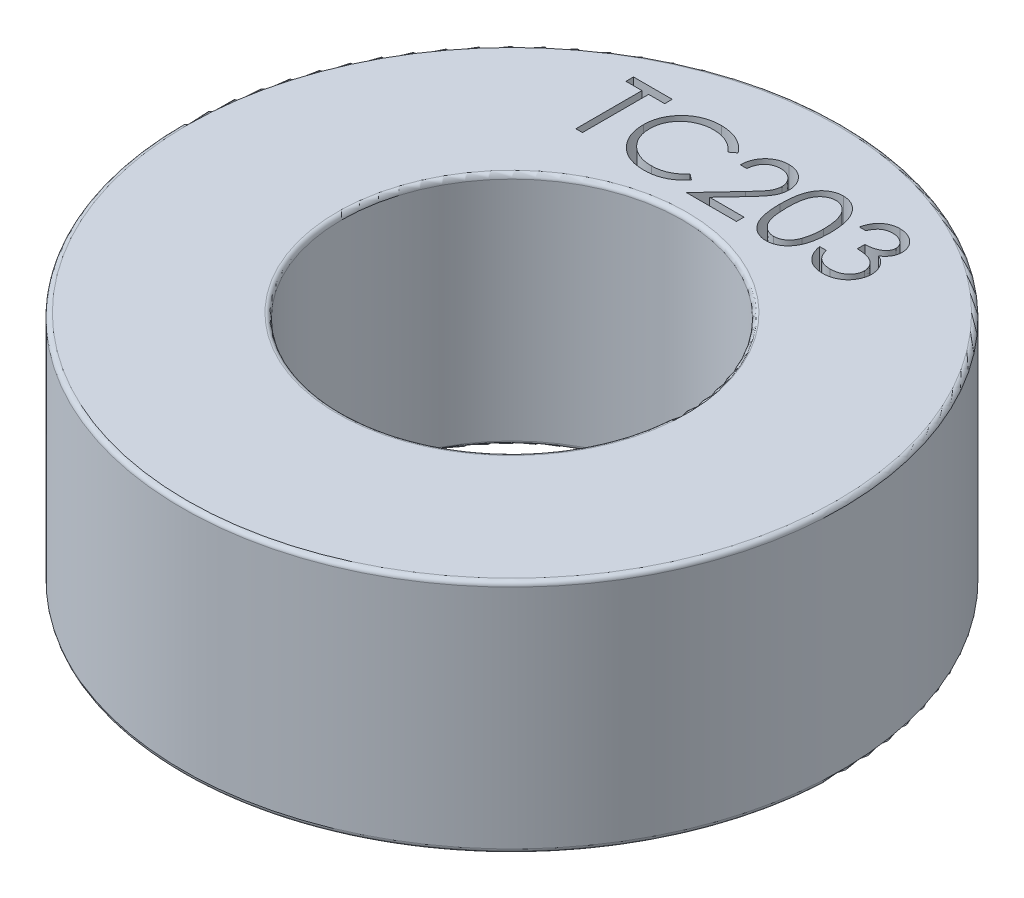
from build123d import *

# Parameters (mm, degrees)
CUT_EXTRUDE1_DEPTH = 1


with BuildPart() as part:
    # Toroidal Core TC229 → Revolve2 (revolve)
    with BuildSketch(Plane.XY, mode=Mode.PRIVATE) as revolve2_sk:
        with BuildLine():
            Line((5.646058459, 0), (10.503941541, 0))
            ThreePointArc((10.503941541, 0), (10.607220468, 0.042779532), (10.65, 0.146058459))
            Line((10.65, 0.146058459), (10.65, 7.473941541))
            ThreePointArc((10.65, 7.473941541), (10.607220468, 7.577220468), (10.503941541, 7.62))
            Line((10.503941541, 7.62), (5.646058459, 7.62))
            ThreePointArc((5.646058459, 7.62), (5.542779532, 7.577220468), (5.5, 7.473941541))
            Line((5.5, 7.473941541), (5.5, 0.146058459))
            ThreePointArc((5.5, 0.146058459), (5.542779532, 0.042779532), (5.646058459, 0))
        make_face()
    revolve(revolve2_sk.sketch.rotate(Axis((0, -8.107972275, 0), (0, 1, 0)), 90), axis=Axis((0, -8.107972275, 0), (0, 1, 0)))

    # Sketch1 → Cut-Extrude1 (cut)
    # profile 1 of 5: a face of its own
    with BuildSketch(Plane(origin=(0, 7.62, 0), x_dir=(1, 0, 0), z_dir=(0, 1, 0))):
        Polygon((-4.639181187, 8.322520552), (-4.639181187, 8.566751321), (-3.387498495, 8.566751321), (-3.387498495, 8.322520552), (-3.90648888, 8.322520552), (-3.90648888, 6.185501321), (-4.120190803, 6.185501321), (-4.120190803, 8.322520552), align=None)
    # profile 2 of 5: a face of its own
    with BuildSketch(Plane(origin=(0, 7.62, 0), x_dir=(1, 0, 0), z_dir=(0, 1, 0))):
        with BuildLine():
            Line((-0.823075418, 8.129807211), (-1.010064601, 7.986703244))
            add(Edge.make_bspline(
                [(-1.010064601, 7.986703244), (-1.023403607, 8.002600449), (-1.049901781, 8.034180529), (-1.092532417, 8.078525898), (-1.136960856, 8.120072085), (-1.183170115, 8.159017006), (-1.231991945, 8.19399877), (-1.282243666, 8.22684036), (-1.334765908, 8.256277874), (-1.407395213, 8.291971442), (-1.502405624, 8.329218379), (-1.622008899, 8.360448971), (-1.746861985, 8.380329806), (-1.832041066, 8.382483029), (-1.875366584, 8.383578244)],
                knots=[0, 0, 0, 0, 0.757959112, 1.505699292, 2.245454638, 2.979532153, 3.711538275, 4.438200793, 5.171680507, 5.909471876, 7.393775596, 8.890124382, 10.418191784, 12, 12, 12, 12], degree=3))
            add(Edge.make_bspline(
                [(-1.875366584, 8.383578244), (-1.899235757, 8.383303406), (-1.946752575, 8.382756279), (-2.017270555, 8.375538285), (-2.086471756, 8.365393337), (-2.154311164, 8.350340215), (-2.220702427, 8.331308844), (-2.286079579, 8.308567625), (-2.349496076, 8.280431564), (-2.411829199, 8.249333623), (-2.471550412, 8.214208522), (-2.528057507, 8.175895331), (-2.581144392, 8.134822785), (-2.630853062, 8.090836943), (-2.677234334, 8.044135895), (-2.71995213, 7.994221941), (-2.758858632, 7.941254658), (-2.794725037, 7.885932501), (-2.826846557, 7.82841661), (-2.853740993, 7.768494107), (-2.877556978, 7.707191137), (-2.896402355, 7.643815079), (-2.911318857, 7.578811876), (-2.921611071, 7.512007072), (-2.928746977, 7.44354023), (-2.929291383, 7.397133536), (-2.929565803, 7.373741255)],
                knots=[0, 0, 0, 0, 1.054917814, 2.100044995, 3.131103042, 4.146048494, 5.169673617, 6.183595914, 7.203665975, 8.234915748, 9.262203917, 10.264457458, 11.251630812, 12.227803204, 13.197192746, 14.159520551, 15.12972552, 16.100847026, 17.073214652, 18.039054194, 19.002613845, 19.979014051, 20.95965708, 21.949030935, 22.966165397, 24, 24, 24, 24], degree=3))
            add(Edge.make_bspline(
                [(-2.929565803, 7.373741255), (-2.928707315, 7.338545482), (-2.927021789, 7.26944325), (-2.912021047, 7.168226103), (-2.889225619, 7.071261144), (-2.855061092, 6.979154502), (-2.812934024, 6.890770422), (-2.759702465, 6.807604345), (-2.698050857, 6.728399504), (-2.627107011, 6.655027784), (-2.549270196, 6.588003268), (-2.465757778, 6.52898189), (-2.376777754, 6.479781943), (-2.283312582, 6.438840808), (-2.18464303, 6.407369713), (-2.08094653, 6.385214479), (-1.972448619, 6.37076221), (-1.898310509, 6.369378576), (-1.860579174, 6.368674398)],
                knots=[0, 0, 0, 0, 1.029171465, 2.020641659, 2.987623507, 3.938342917, 4.889210282, 5.84687017, 6.821220943, 7.821438502, 8.827599549, 9.822697543, 10.807740252, 11.797342354, 12.80366471, 13.83203677, 14.896651826, 16, 16, 16, 16], degree=3))
            add(Edge.make_bspline(
                [(-1.860579174, 6.368674398), (-1.819007523, 6.369823372), (-1.737184569, 6.372084826), (-1.617191323, 6.391243172), (-1.502322704, 6.422306863), (-1.392572533, 6.465780271), (-1.288250212, 6.522294333), (-1.189192484, 6.590804853), (-1.095315737, 6.671963522), (-1.038865632, 6.733932579), (-1.010064601, 6.765549398)],
                knots=[0, 0, 0, 0, 1.028121516, 2.023589091, 2.998037872, 3.967518031, 4.937445131, 5.927275754, 6.942489185, 8, 8, 8, 8], degree=3))
            Line((-1.010064601, 6.765549398), (-0.823075418, 6.623876472))
            add(Edge.make_bspline(
                [(-0.823075418, 6.623876472), (-0.838123632, 6.604460132), (-0.86814798, 6.565720456), (-0.916764952, 6.511107025), (-0.967980399, 6.459737315), (-1.022174731, 6.412025487), (-1.078724514, 6.367016824), (-1.138645141, 6.325990042), (-1.201148893, 6.288372494), (-1.266023994, 6.253928104), (-1.333201514, 6.223368335), (-1.40260096, 6.197206039), (-1.473923191, 6.174669284), (-1.547171467, 6.156128234), (-1.622497723, 6.1416563), (-1.699630135, 6.131981843), (-1.778735175, 6.125353862), (-1.832103356, 6.124749762), (-1.859148134, 6.124443629)],
                knots=[0, 0, 0, 0, 0.986787822, 1.968848986, 2.935600012, 3.899624008, 4.868462664, 5.837806735, 6.815139263, 7.798259679, 8.787526145, 9.778297419, 10.776456485, 11.791383307, 12.812564526, 13.85620153, 14.913611965, 16, 16, 16, 16], degree=3))
            add(Edge.make_bspline(
                [(-1.859148134, 6.124443629), (-1.884759272, 6.124621878), (-1.935402126, 6.124974342), (-2.010172526, 6.130684013), (-2.082963652, 6.138473923), (-2.15356746, 6.15020337), (-2.222369239, 6.164044787), (-2.28874528, 6.182598981), (-2.353348735, 6.203383325), (-2.415920053, 6.227811539), (-2.476512456, 6.255377013), (-2.534930513, 6.286531627), (-2.591147357, 6.321013396), (-2.645715688, 6.358062251), (-2.697829401, 6.398868237), (-2.747940103, 6.442864644), (-2.796328788, 6.489903183), (-2.826266329, 6.523822289), (-2.841318357, 6.540876171)],
                knots=[0, 0, 0, 0, 1.114604814, 2.203992996, 3.262667896, 4.300477797, 5.318619304, 6.316056647, 7.298880507, 8.271930387, 9.238335007, 10.195173496, 11.151986948, 12.108099108, 13.064862484, 14.031167946, 15.010108607, 16, 16, 16, 16], degree=3))
            add(Edge.make_bspline(
                [(-2.841318357, 6.540876171), (-2.86542725, 6.57049973), (-2.913353973, 6.629389206), (-2.974671625, 6.724833776), (-3.027159515, 6.824484468), (-3.069597419, 6.928864812), (-3.102773492, 7.037740588), (-3.12575677, 7.151166679), (-3.140691701, 7.269037154), (-3.142399594, 7.349208255), (-3.143267726, 7.389959705)],
                knots=[0, 0, 0, 0, 0.994628077, 1.977248131, 2.950237994, 3.925870899, 4.908910175, 5.911660606, 6.938484602, 8, 8, 8, 8], degree=3))
            add(Edge.make_bspline(
                [(-3.143267726, 7.389959705), (-3.142209639, 7.432791897), (-3.140127918, 7.517061562), (-3.122441493, 7.64073277), (-3.093989777, 7.759217918), (-3.053578679, 7.872295823), (-3.002344146, 7.980561245), (-2.939052824, 8.083187136), (-2.864440001, 8.180829816), (-2.779090852, 8.27200771), (-2.685495933, 8.355378233), (-2.585266526, 8.428724954), (-2.478598808, 8.489764907), (-2.366667913, 8.540789082), (-2.24863569, 8.580007904), (-2.124753969, 8.607462483), (-1.995255529, 8.624551092), (-1.9069027, 8.626711368), (-1.862010214, 8.627809014)],
                knots=[0, 0, 0, 0, 1.032925535, 2.032216505, 3.007276963, 3.968222605, 4.92396291, 5.891752235, 6.871517503, 7.883894988, 8.900124299, 9.891468569, 10.874487609, 11.85992873, 12.854644235, 13.869047385, 14.917252991, 16, 16, 16, 16], degree=3))
            add(Edge.make_bspline(
                [(-1.862010214, 8.627809014), (-1.83465001, 8.627480988), (-1.780493244, 8.626831693), (-1.700379385, 8.620500193), (-1.622381659, 8.6099454), (-1.546446331, 8.595578931), (-1.472203979, 8.577748592), (-1.40022203, 8.554520997), (-1.330078102, 8.527962214), (-1.26221458, 8.4973744), (-1.19695707, 8.463038992), (-1.134325896, 8.425336577), (-1.074818555, 8.384313895), (-1.01801632, 8.340319842), (-0.964869398, 8.292423679), (-0.913868821, 8.241942815), (-0.866746552, 8.187423195), (-0.83765911, 8.149047695), (-0.823075418, 8.129807211)],
                knots=[0, 0, 0, 0, 1.096760587, 2.17092713, 3.219439832, 4.250915756, 5.268269357, 6.278326846, 7.281116186, 8.274029601, 9.260640565, 10.235837813, 11.203064059, 12.156899882, 13.114053108, 14.069676657, 15.032185724, 16, 16, 16, 16], degree=3))
        make_face()
    # profile 3 of 5: a face of its own
    with BuildSketch(Plane(origin=(0, 7.62, 0), x_dir=(1, 0, 0), z_dir=(0, 1, 0))):
        with BuildLine():
            Line((-0.243027341, 7.834059014), (-0.456729264, 7.834059014))
            add(Edge.make_bspline(
                [(-0.456729264, 7.834059014), (-0.455336469, 7.8624101), (-0.452601056, 7.918090879), (-0.439791095, 7.999273751), (-0.421461677, 8.076871748), (-0.395545884, 8.150261814), (-0.36336072, 8.22009286), (-0.324764041, 8.286087513), (-0.279048225, 8.347994018), (-0.227200429, 8.405238481), (-0.170888194, 8.457753597), (-0.11012826, 8.503102967), (-0.046280126, 8.541419097), (0.020462501, 8.573451156), (0.090852635, 8.597494873), (0.164251507, 8.615334953), (0.240981598, 8.626068502), (0.293260256, 8.627222242), (0.31984826, 8.627809014)],
                knots=[0, 0, 0, 0, 1.10065271, 2.161652631, 3.183658789, 4.190468796, 5.17591951, 6.163126047, 7.15150782, 8.156236427, 9.156009102, 10.134482811, 11.092018607, 12.041330605, 13.001268258, 13.972401359, 14.968799086, 16, 16, 16, 16], degree=3))
            add(Edge.make_bspline(
                [(0.31984826, 8.627809014), (0.345959057, 8.627197742), (0.39726584, 8.625996616), (0.472147317, 8.615681702), (0.543433298, 8.599526219), (0.610984439, 8.576859837), (0.67426178, 8.546390432), (0.733740672, 8.509788893), (0.790129224, 8.467457186), (0.840888482, 8.417618431), (0.887498443, 8.36441288), (0.927709085, 8.307611288), (0.962144112, 8.248944578), (0.990846801, 8.187965391), (1.011976067, 8.124099566), (1.02801767, 8.058276915), (1.037085071, 7.989816107), (1.038476689, 7.943479325), (1.039184197, 7.919921394)],
                knots=[0, 0, 0, 0, 1.111607364, 2.184268762, 3.212621178, 4.221274766, 5.211760367, 6.196651075, 7.1921475, 8.207485113, 9.220403448, 10.201281604, 11.166441695, 12.114753415, 13.065576456, 14.026450734, 14.996634279, 16, 16, 16, 16], degree=3))
            add(Edge.make_bspline(
                [(1.039184197, 7.919921394), (1.038032174, 7.886755456), (1.035748343, 7.821005596), (1.016212312, 7.72438477), (0.985700668, 7.630772105), (0.94896318, 7.55543119), (0.911902464, 7.494720545), (0.878505428, 7.444735587), (0.839408833, 7.390915617), (0.794043641, 7.333440857), (0.743348276, 7.271861116), (0.686863554, 7.206213595), (0.624186685, 7.137176551), (0.580195812, 7.09002399), (0.557400844, 7.065590714)],
                knots=[0, 0, 0, 0, 1.184426356, 2.348067706, 3.509069118, 4.696110526, 5.333549288, 6.050745305, 6.844228056, 7.710549037, 8.667450064, 9.695053472, 10.805634456, 12, 12, 12, 12], degree=3))
            Line((0.557400844, 7.065590714), (-0.038388669, 6.429732091))
            Line((-0.038388669, 6.429732091), (1.069713043, 6.429732091))
            Line((1.069713043, 6.429732091), (1.069713043, 6.185501321))
            Line((1.069713043, 6.185501321), (-0.548315803, 6.185501321))
            Line((-0.548315803, 6.185501321), (0.375181793, 7.171010636))
            add(Edge.make_bspline(
                [(0.375181793, 7.171010636), (0.397666159, 7.194481806), (0.440854025, 7.239565118), (0.501938242, 7.305384882), (0.556801554, 7.366446623), (0.605799101, 7.422634971), (0.647867968, 7.474771806), (0.685200683, 7.52116856), (0.715112987, 7.563863998), (0.747576497, 7.613353594), (0.77901851, 7.673777689), (0.806037095, 7.74761936), (0.82251184, 7.823633794), (0.824488166, 7.875002144), (0.825482274, 7.900840865)],
                knots=[0, 0, 0, 0, 1.329631726, 2.553950428, 3.673215718, 4.687767853, 5.603093632, 6.413772471, 7.123043292, 7.734684054, 8.834405432, 9.900288307, 10.943827018, 12, 12, 12, 12], degree=3))
            add(Edge.make_bspline(
                [(0.825482274, 7.900840865), (0.825049742, 7.917088745), (0.824197305, 7.949110196), (0.816674122, 7.996058757), (0.80530501, 8.041346604), (0.789013682, 8.085113039), (0.767509811, 8.126918027), (0.741334172, 8.166812456), (0.711133075, 8.205381198), (0.676195872, 8.241544424), (0.637815892, 8.27466503), (0.597270519, 8.30400481), (0.55437393, 8.328524276), (0.50930699, 8.348624406), (0.46219534, 8.364391942), (0.412947861, 8.375317511), (0.361700629, 8.382177201), (0.326707483, 8.383105325), (0.308876956, 8.383578244)],
                knots=[0, 0, 0, 0, 0.991446411, 1.95395049, 2.89581595, 3.838931463, 4.798493298, 5.75982156, 6.748411868, 7.785213223, 8.824556874, 9.840280684, 10.836137867, 11.835679398, 12.848801643, 13.863922112, 14.911575587, 16, 16, 16, 16], degree=3))
            add(Edge.make_bspline(
                [(0.308876956, 8.383578244), (0.290255014, 8.383091767), (0.253684596, 8.382136406), (0.199991468, 8.375453486), (0.148770251, 8.363924263), (0.0998921, 8.348155847), (0.05327431, 8.328113513), (0.009143594, 8.303150022), (-0.032400979, 8.27336161), (-0.071437506, 8.239588303), (-0.107403892, 8.201986596), (-0.139004356, 8.160069817), (-0.16661598, 8.114603308), (-0.190706904, 8.065709747), (-0.210271044, 8.012945479), (-0.225220633, 7.956497809), (-0.237049899, 7.896611833), (-0.241001767, 7.855256266), (-0.243027341, 7.834059014)],
                knots=[0, 0, 0, 0, 1.031018746, 2.02475058, 2.990194455, 3.934040569, 4.864654155, 5.795059489, 6.735614925, 7.690564532, 8.649604399, 9.611025574, 10.590972636, 11.591080095, 12.624614302, 13.701020113, 14.821632451, 16, 16, 16, 16], degree=3))
        make_face()
    # profile 4 of 5: a face of its own
    with BuildSketch(Plane(origin=(0, 7.62, 0), x_dir=(1, 0, 0), z_dir=(0, 1, 0))):
        with BuildLine():
            add(Edge.make_bspline(
                [(1.283414967, 7.375172295), (1.283638136, 7.413338553), (1.284071646, 7.487477061), (1.288894304, 7.595507326), (1.296905742, 7.696853523), (1.307884919, 7.791520501), (1.321245759, 7.879532702), (1.339081653, 7.960654921), (1.359365006, 8.035262617), (1.382873009, 8.103599082), (1.40939863, 8.166584984), (1.438269082, 8.225384987), (1.47063013, 8.279910123), (1.50463228, 8.331030655), (1.541651921, 8.377909776), (1.580635563, 8.421209516), (1.623104732, 8.459929152), (1.667615743, 8.495203154), (1.714571587, 8.526125027), (1.76263383, 8.553361587), (1.812133286, 8.57662971), (1.8632051, 8.594924811), (1.915390233, 8.610036119), (1.968871112, 8.620370028), (2.02373604, 8.626872139), (2.060768856, 8.627493759), (2.079550033, 8.627809014)],
                knots=[0, 0, 0, 0, 1.646270934, 3.197905019, 4.663502075, 6.030701355, 7.308322542, 8.50163776, 9.611534131, 10.641858119, 11.616356847, 12.558055219, 13.465016945, 14.349605745, 15.204443733, 16.039544428, 16.859896111, 17.680448484, 18.487036065, 19.28249412, 20.06191084, 20.843045899, 21.620316918, 22.403196591, 23.190181807, 24, 24, 24, 24], degree=3))
            add(Edge.make_bspline(
                [(2.079550033, 8.627809014), (2.098488099, 8.627477125), (2.136149955, 8.626817103), (2.191830639, 8.620473492), (2.246224976, 8.609947603), (2.299101067, 8.595033512), (2.350893245, 8.576530739), (2.401196408, 8.553339325), (2.450323012, 8.526343524), (2.497492368, 8.494622636), (2.543222312, 8.459256123), (2.586389587, 8.419276522), (2.626998122, 8.375087517), (2.665557571, 8.327161891), (2.700973968, 8.274580432), (2.734701607, 8.218257671), (2.764890439, 8.157208637), (2.79396528, 8.092451925), (2.819061605, 8.022195758), (2.841694533, 7.946836162), (2.859981831, 7.865483009), (2.875214532, 7.778563135), (2.887015256, 7.68575733), (2.895609964, 7.587264533), (2.900150045, 7.483019946), (2.901005051, 7.411747195), (2.901443813, 7.375172295)],
                knots=[0, 0, 0, 0, 0.810914788, 1.612654377, 2.396697861, 3.181598691, 3.963628158, 4.749916497, 5.551656086, 6.361998678, 7.18212741, 8.025565596, 8.878627764, 9.750805457, 10.657531673, 11.591944965, 12.560506719, 13.57287815, 14.630710178, 15.753379473, 16.941251878, 18.199788006, 19.531962791, 20.947069417, 22.433333509, 24, 24, 24, 24], degree=3))
            add(Edge.make_bspline(
                [(2.901443813, 7.375172295), (2.901000503, 7.338756922), (2.900136731, 7.267803052), (2.895660861, 7.164027514), (2.886844363, 7.066057417), (2.875815782, 6.973657798), (2.860541109, 6.88721324), (2.841759737, 6.806424606), (2.820906571, 6.730943015), (2.795165398, 6.66138683), (2.766991326, 6.596785747), (2.736337701, 6.53646042), (2.70349698, 6.479877638), (2.667717852, 6.427490311), (2.629581512, 6.378927331), (2.588271731, 6.335045913), (2.544952993, 6.294788724), (2.499088475, 6.258966813), (2.451183473, 6.227612687), (2.402225601, 6.199572549), (2.351346192, 6.176962448), (2.299698272, 6.157548429), (2.24654308, 6.142716336), (2.191946875, 6.132460731), (2.136187365, 6.125268098), (2.098494514, 6.124719404), (2.079550033, 6.124443629)],
                knots=[0, 0, 0, 0, 1.561518951, 3.042555995, 4.452378317, 5.7783523, 7.031515105, 8.214008947, 9.334062868, 10.386615937, 11.391082383, 12.354592575, 13.286541444, 14.194233754, 15.072674879, 15.931287219, 16.775624067, 17.606195743, 18.42308326, 19.229000347, 20.022332153, 20.807536673, 21.593273796, 22.3848459, 23.188221202, 24, 24, 24, 24], degree=3))
            add(Edge.make_bspline(
                [(2.079550033, 6.124443629), (2.060769377, 6.124760917), (2.023737588, 6.125386548), (1.968865135, 6.131859283), (1.915605115, 6.142265688), (1.863694713, 6.156836627), (1.812867602, 6.174672079), (1.763816378, 6.197908781), (1.71599565, 6.224669996), (1.669533003, 6.255146881), (1.625301514, 6.290063955), (1.583052285, 6.328683944), (1.543846691, 6.371970586), (1.507356351, 6.419240387), (1.472675766, 6.470058468), (1.440774246, 6.525118665), (1.411266576, 6.584202655), (1.384294844, 6.647692163), (1.3603812, 6.71651364), (1.33925767, 6.791454421), (1.322579287, 6.873175952), (1.308303384, 6.961021875), (1.296788759, 7.055369674), (1.288927691, 7.156270569), (1.284069047, 7.263661685), (1.283636972, 7.337323799), (1.283414967, 7.375172295)],
                knots=[0, 0, 0, 0, 0.810891512, 1.598919785, 2.382837074, 3.152667961, 3.926044502, 4.706494248, 5.493654104, 6.291793342, 7.103789334, 7.925228297, 8.761435821, 9.622817696, 10.50288917, 11.416980706, 12.369136599, 13.353924996, 14.394355917, 15.514179734, 16.714354668, 17.994756427, 19.357759367, 20.818452758, 22.365282078, 24, 24, 24, 24], degree=3))
        make_face()
        with BuildLine():
            add(Edge.make_bspline(
                [(1.49711689, 7.376126321), (1.497198156, 7.34432051), (1.497355879, 7.282591676), (1.501476258, 7.192891172), (1.507089363, 7.10922743), (1.514329245, 7.031494221), (1.525080894, 6.959954659), (1.537127834, 6.894116713), (1.55178823, 6.834328808), (1.569133948, 6.780180672), (1.588890905, 6.730753359), (1.610462216, 6.68476039), (1.633635672, 6.641658447), (1.659570308, 6.601834689), (1.687815378, 6.565159245), (1.717732899, 6.530982979), (1.750439425, 6.500505032), (1.795685721, 6.463951583), (1.85541868, 6.426178744), (1.930680096, 6.393286136), (2.008015239, 6.372615215), (2.060505643, 6.369986481), (2.086705231, 6.368674398)],
                knots=[0, 0, 0, 0, 1.459021318, 2.831673884, 4.118529203, 5.306027144, 6.411944654, 7.436330062, 8.375795394, 9.233974572, 10.042671642, 10.816086306, 11.563610507, 12.285937304, 12.993564865, 13.685989202, 14.367179055, 15.041617293, 16.353048772, 17.594441528, 18.799311195, 20, 20, 20, 20], degree=3))
            add(Edge.make_bspline(
                [(2.086705231, 6.368674398), (2.11307429, 6.36976146), (2.165757965, 6.371933339), (2.242729351, 6.39288748), (2.317453159, 6.424503363), (2.376012819, 6.461887291), (2.420564335, 6.497489243), (2.452484644, 6.527843138), (2.481782217, 6.561830969), (2.509569414, 6.59850174), (2.535054964, 6.638556055), (2.558230063, 6.681801307), (2.57937784, 6.728357587), (2.591426316, 6.76085807), (2.597586391, 6.777474729)],
                knots=[0, 0, 0, 0, 1.353760809, 2.704726607, 4.075137775, 5.516104923, 6.260822281, 7.007110065, 7.778089737, 8.566572457, 9.372053459, 10.217411131, 11.088608312, 12, 12, 12, 12], degree=3))
            add(Edge.make_bspline(
                [(2.597586391, 6.777474729), (2.604765361, 6.798722105), (2.61934175, 6.841863391), (2.638127618, 6.908785804), (2.652922256, 6.979000542), (2.666232332, 7.052087988), (2.675317179, 7.128587141), (2.68262953, 7.208261306), (2.686936658, 7.291170554), (2.687470569, 7.347500718), (2.68774189, 7.376126321)],
                knots=[0, 0, 0, 0, 0.884706709, 1.796334032, 2.740027952, 3.714592787, 4.726048262, 5.777819803, 6.87074269, 8, 8, 8, 8], degree=3))
            add(Edge.make_bspline(
                [(2.68774189, 7.376126321), (2.687367564, 7.404747295), (2.686635304, 7.460736037), (2.683836323, 7.542731442), (2.676608499, 7.620610401), (2.668580884, 7.694708419), (2.65674456, 7.764615322), (2.643982552, 7.830916333), (2.626836728, 7.892790069), (2.608521666, 7.951205249), (2.587559594, 8.005498194), (2.564484782, 8.055922038), (2.539841049, 8.102720217), (2.513074275, 8.145764333), (2.484502212, 8.185247188), (2.453370737, 8.220377153), (2.420914726, 8.252243019), (2.375455176, 8.28861666), (2.315941418, 8.325704081), (2.241887505, 8.359834714), (2.164823013, 8.379434642), (2.112725716, 8.382198039), (2.086705231, 8.383578244)],
                knots=[0, 0, 0, 0, 1.31362396, 2.569729283, 3.763502607, 4.902122613, 5.988968491, 7.01645872, 7.998833611, 8.933434873, 9.825090667, 10.667526885, 11.477055099, 12.250526234, 12.991942729, 13.710640831, 14.402115721, 15.076753259, 16.378508321, 17.609869233, 18.806226677, 20, 20, 20, 20], degree=3))
            add(Edge.make_bspline(
                [(2.086705231, 8.383578244), (2.060368203, 8.382196135), (2.007646168, 8.379429399), (1.929780684, 8.359907739), (1.855142545, 8.32588106), (1.795786164, 8.288493821), (1.750294909, 8.252885077), (1.718261863, 8.222006079), (1.688226699, 8.188228895), (1.660558139, 8.151216164), (1.634643823, 8.111438833), (1.610844241, 8.068583977), (1.589401201, 8.022434424), (1.569613329, 7.973029314), (1.5522147, 7.91888585), (1.537863271, 7.859171588), (1.524605115, 7.793543051), (1.515219406, 7.721616029), (1.506875672, 7.643863349), (1.50151354, 7.559990745), (1.497342096, 7.470139801), (1.497193462, 7.408091802), (1.49711689, 7.376126321)],
                knots=[0, 0, 0, 0, 1.207732386, 2.417664972, 3.655092373, 4.956220595, 5.625982001, 6.301752483, 6.994047911, 7.697131622, 8.419323945, 9.170223765, 9.943494443, 10.752040957, 11.610060368, 12.549350801, 13.567764191, 14.679664412, 15.874934091, 17.154273443, 18.533957287, 20, 20, 20, 20], degree=3))
        make_face(mode=Mode.SUBTRACT)
    # profile 5 of 5: a face of its own
    with BuildSketch(Plane(origin=(0, 7.62, 0), x_dir=(1, 0, 0), z_dir=(0, 1, 0))):
        with BuildLine():
            Line((3.420434197, 8.017232091), (3.206732274, 8.017232091))
            add(Edge.make_bspline(
                [(3.206732274, 8.017232091), (3.212521808, 8.041202763), (3.223839872, 8.088063466), (3.247446614, 8.155015549), (3.273163608, 8.218372802), (3.304044409, 8.276948881), (3.337728044, 8.331920991), (3.376319753, 8.382042306), (3.418039064, 8.428587556), (3.464184252, 8.469894241), (3.512577145, 8.507298732), (3.563899628, 8.539190512), (3.617119132, 8.566625337), (3.672604389, 8.589226959), (3.730520588, 8.606253253), (3.790344135, 8.618606365), (3.852231802, 8.626628534), (3.894242216, 8.627411464), (3.915573921, 8.627809014)],
                knots=[0, 0, 0, 0, 1.162005537, 2.271625781, 3.343758855, 4.383309926, 5.390229558, 6.379919256, 7.361854164, 8.333198761, 9.295911338, 10.242430842, 11.177959212, 12.116337295, 13.062827104, 14.020064771, 14.994644689, 16, 16, 16, 16], degree=3))
            add(Edge.make_bspline(
                [(3.915573921, 8.627809014), (3.946654501, 8.626870645), (4.008137703, 8.625014375), (4.09846399, 8.60806366), (4.185567951, 8.58124049), (4.268496171, 8.5441789), (4.345525141, 8.498467532), (4.414061725, 8.444062952), (4.473176944, 8.382014856), (4.522771154, 8.313480736), (4.561602538, 8.240236541), (4.590236302, 8.164852863), (4.607668196, 8.087508522), (4.609927361, 8.035286159), (4.611059197, 8.009122866)],
                knots=[0, 0, 0, 0, 1.083050992, 2.142477498, 3.193116406, 4.255571735, 5.30263384, 6.308962982, 7.297363603, 8.282367274, 9.249857812, 10.179914175, 11.08814088, 12, 12, 12, 12], degree=3))
            add(Edge.make_bspline(
                [(4.611059197, 8.009122866), (4.61026754, 7.983945029), (4.608718389, 7.934675909), (4.595564564, 7.862747533), (4.573428285, 7.794955658), (4.542764751, 7.731014904), (4.50307166, 7.671330682), (4.454988986, 7.61576871), (4.398177354, 7.564082551), (4.355125076, 7.534473766), (4.332960489, 7.519230288)],
                knots=[0, 0, 0, 0, 1.024540389, 2.004866551, 2.965041327, 3.920577974, 4.882998113, 5.874504559, 6.905732034, 8, 8, 8, 8], degree=3))
            add(Edge.make_bspline(
                [(4.332960489, 7.519230288), (4.35829138, 7.50699871), (4.408479199, 7.482764418), (4.47688947, 7.435237554), (4.538991025, 7.380362432), (4.573623734, 7.337538949), (4.591024642, 7.316022656)],
                knots=[0, 0, 0, 0, 1.015518401, 2.012035669, 3.001164323, 4, 4, 4, 4], degree=3))
            add(Edge.make_bspline(
                [(4.591024642, 7.316022656), (4.60248277, 7.30033515), (4.62521139, 7.269217031), (4.65326628, 7.219185999), (4.678717838, 7.168600432), (4.698550398, 7.116104479), (4.71390869, 7.062306589), (4.724886954, 7.007114388), (4.73170695, 6.950482804), (4.732683638, 6.912170206), (4.733174582, 6.892911928)],
                knots=[0, 0, 0, 0, 1.025084078, 2.033381695, 3.024893161, 4.013698104, 4.991890475, 5.976764909, 6.982997093, 8, 8, 8, 8], degree=3))
            add(Edge.make_bspline(
                [(4.733174582, 6.892911928), (4.731953672, 6.859567814), (4.729517597, 6.793036505), (4.707743397, 6.694742096), (4.673988674, 6.598658317), (4.626052794, 6.506759185), (4.567632221, 6.42077539), (4.498128756, 6.343843115), (4.418332111, 6.277713351), (4.329337553, 6.222461392), (4.232919292, 6.17829402), (4.129793756, 6.147638867), (4.021446844, 6.127673106), (3.947146879, 6.125532112), (3.909372749, 6.124443629)],
                knots=[0, 0, 0, 0, 0.955779014, 1.907060117, 2.875433937, 3.871313158, 4.872415639, 5.851225146, 6.836215519, 7.83643374, 8.849228613, 9.86973379, 10.916971861, 12, 12, 12, 12], degree=3))
            add(Edge.make_bspline(
                [(3.909372749, 6.124443629), (3.883914261, 6.125034324), (3.833820445, 6.126196615), (3.760176208, 6.134142235), (3.689880552, 6.148654256), (3.622838433, 6.168182755), (3.558990292, 6.192942137), (3.498530963, 6.223775037), (3.441088482, 6.260045898), (3.38720491, 6.302182857), (3.33688667, 6.349318911), (3.291470977, 6.402290845), (3.250200654, 6.460119436), (3.214180752, 6.523476372), (3.181770611, 6.591542877), (3.155113567, 6.665190517), (3.131651064, 6.743760896), (3.120742582, 6.798514501), (3.115145736, 6.826607091)],
                knots=[0, 0, 0, 0, 1.048658725, 2.063410685, 3.046034179, 4.001477787, 4.936774919, 5.862367409, 6.792675028, 7.730719943, 8.675894397, 9.627829632, 10.600096036, 11.597688215, 12.626045268, 13.701542398, 14.82072376, 16, 16, 16, 16], degree=3))
            Line((3.115145736, 6.826607091), (3.328847659, 6.826607091))
            add(Edge.make_bspline(
                [(3.328847659, 6.826607091), (3.33441522, 6.808272137), (3.345244609, 6.772609059), (3.363678408, 6.721282709), (3.384679858, 6.674230533), (3.407209584, 6.631107373), (3.430871348, 6.591488542), (3.457347396, 6.556421664), (3.48467676, 6.524366499), (3.505277535, 6.506306683), (3.515359828, 6.497467968)],
                knots=[0, 0, 0, 0, 1.198163088, 2.33053128, 3.407730985, 4.417276592, 5.372219308, 6.28897303, 7.162600585, 8, 8, 8, 8], degree=3))
            add(Edge.make_bspline(
                [(3.515359828, 6.497467968), (3.528692499, 6.487188905), (3.555316686, 6.466662509), (3.598701857, 6.440467651), (3.644329932, 6.417770239), (3.693189558, 6.400432224), (3.744226393, 6.385751709), (3.798265368, 6.376144713), (3.854829729, 6.369553296), (3.893452082, 6.368971637), (3.913188855, 6.368674398)],
                knots=[0, 0, 0, 0, 0.946170439, 1.889420265, 2.845303464, 3.807233317, 4.801018734, 5.828864929, 6.890507805, 8, 8, 8, 8], degree=3))
            add(Edge.make_bspline(
                [(3.913188855, 6.368674398), (3.935472934, 6.369093434), (3.979047528, 6.369912822), (4.042630209, 6.377448258), (4.103119026, 6.3884227), (4.159842392, 6.405372426), (4.213543326, 6.426314398), (4.263469056, 6.452609117), (4.310274978, 6.483459722), (4.353361591, 6.518524757), (4.392104874, 6.556911524), (4.42621765, 6.597061488), (4.455217643, 6.638805365), (4.478610756, 6.682374158), (4.497082827, 6.727587448), (4.509658004, 6.774572116), (4.518401624, 6.822943648), (4.519113694, 6.855824608), (4.519472659, 6.87240036)],
                knots=[0, 0, 0, 0, 1.217147791, 2.380027433, 3.494444702, 4.572153297, 5.609568379, 6.639424714, 7.649109417, 8.668170816, 9.669597737, 10.625200337, 11.543417969, 12.441394052, 13.322311151, 14.205496177, 15.095365482, 16, 16, 16, 16], degree=3))
            add(Edge.make_bspline(
                [(4.519472659, 6.87240036), (4.518431507, 6.894587717), (4.516354385, 6.938852031), (4.500496226, 7.003974166), (4.474412106, 7.066719023), (4.43789563, 7.126016088), (4.393444, 7.180972549), (4.34148859, 7.230006897), (4.281597956, 7.270467798), (4.22647551, 7.298422759), (4.177649573, 7.317497984), (4.135865177, 7.330203629), (4.089086131, 7.340962563), (4.037878133, 7.350972162), (3.981855338, 7.35949115), (3.921078736, 7.366595314), (3.855536012, 7.372279726), (3.810162201, 7.374818203), (3.786780351, 7.376126321)],
                knots=[0, 0, 0, 0, 1.07054697, 2.135767047, 3.216561865, 4.33974944, 5.486079747, 6.621378074, 7.775625952, 8.963672916, 9.598146892, 10.304877434, 11.070270905, 11.915000392, 12.823868403, 13.805723172, 14.86925407, 16, 16, 16, 16], degree=3))
            Line((3.786780351, 7.376126321), (3.786780351, 7.620357091))
            add(Edge.make_bspline(
                [(3.786780351, 7.620357091), (3.816240609, 7.62085702), (3.873946016, 7.621836258), (3.958238391, 7.633679922), (4.038842555, 7.650063349), (4.113972178, 7.675158453), (4.182449249, 7.704305155), (4.241857764, 7.738222462), (4.291365412, 7.775924282), (4.330731606, 7.81799254), (4.360347027, 7.863110456), (4.382000616, 7.910134468), (4.394791552, 7.959476731), (4.396499022, 7.993150782), (4.397357274, 8.010076892)],
                knots=[0, 0, 0, 0, 1.321986639, 2.589447074, 3.816329219, 5.01088745, 6.139805852, 7.153945165, 8.075214402, 8.924034688, 9.728124013, 10.488707548, 11.240355623, 12, 12, 12, 12], degree=3))
            add(Edge.make_bspline(
                [(4.397357274, 8.010076892), (4.397075327, 8.022512287), (4.396514406, 8.047251914), (4.389440543, 8.083395934), (4.378810616, 8.118434971), (4.364196728, 8.152220017), (4.344636325, 8.184516756), (4.321227967, 8.215600539), (4.293355027, 8.245293895), (4.261415357, 8.272971041), (4.227117325, 8.299347969), (4.189527746, 8.321740997), (4.149780006, 8.340889691), (4.1078301, 8.356680441), (4.063541891, 8.368558993), (4.017123465, 8.377087842), (3.968486309, 8.382420247), (3.935304113, 8.383187972), (3.918436, 8.383578244)],
                knots=[0, 0, 0, 0, 0.884392785, 1.759457502, 2.611959086, 3.489218968, 4.37281399, 5.2945488, 6.255912374, 7.266815255, 8.301784654, 9.332968512, 10.37626691, 11.440494194, 12.520033166, 13.637162961, 14.798855837, 16, 16, 16, 16], degree=3))
            add(Edge.make_bspline(
                [(3.918436, 8.383578244), (3.891322633, 8.382631621), (3.838363921, 8.380782646), (3.762017701, 8.364588096), (3.691043297, 8.338749436), (3.636792526, 8.307906792), (3.596731346, 8.277460515), (3.568104, 8.250870534), (3.539991296, 8.221320702), (3.514242719, 8.186990986), (3.488202746, 8.150206259), (3.464496, 8.109096576), (3.441459316, 8.064734301), (3.427578296, 8.033372806), (3.420434197, 8.017232091)],
                knots=[0, 0, 0, 0, 1.472543308, 2.876219568, 4.221790263, 5.565193594, 6.249813518, 6.953379497, 7.687249741, 8.463570142, 9.283606569, 10.136032583, 11.040678096, 12, 12, 12, 12], degree=3))
        make_face()
    extrude(amount=-CUT_EXTRUDE1_DEPTH, mode=Mode.SUBTRACT)


solid = part.part
